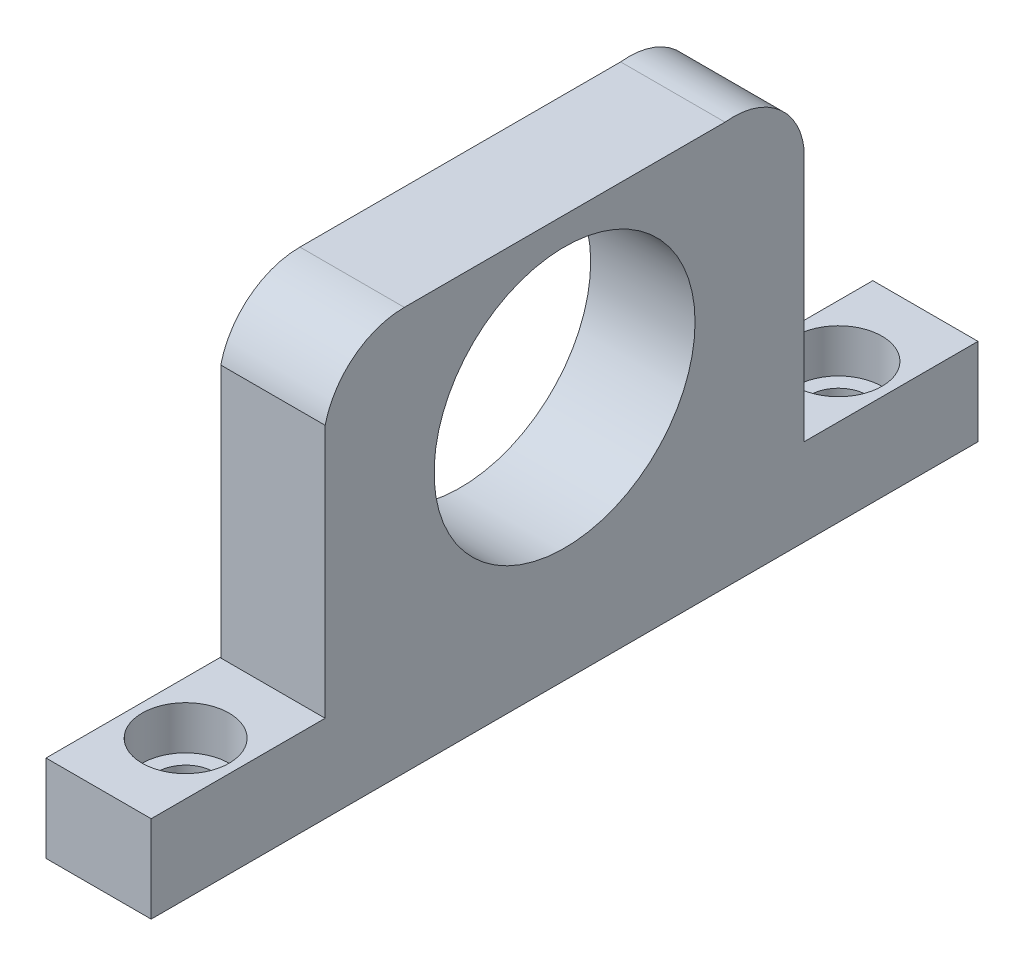
from build123d import *

# Parameters (mm, degrees)
SKETCH1_W           = 2.417978287
SKETCH1_H           = 19.01
SKETCH1_R           = 0.655
BOSS_EXTRUDE1_DEPTH = 2
SKETCH2_R           = 1
CUT_EXTRUDE1_DEPTH  = 1
SKETCH4_R           = 3
BOSS_EXTRUDE3_DEPTH = 2.4


with BuildPart() as part:
    # Sketch1 → Boss-Extrude1 (new body)
    with BuildSketch(Plane(origin=(0, 0, 0), x_dir=(1, 0, 0), z_dir=(0, 1, 0))):
        with Locations((-1.208989143, 14.330251099)):
            Rectangle(SKETCH1_W, SKETCH1_H)
        with Locations(Location((-1.207978287, 6.825251099, 0), (0, 0, 270))):
            Circle(SKETCH1_R, mode=Mode.SUBTRACT)
        with Locations(Location((-1.207978287, 21.835251099, 0), (0, 0, 270))):
            Circle(SKETCH1_R, mode=Mode.SUBTRACT)
    extrude(amount=BOSS_EXTRUDE1_DEPTH)

    # Sketch2 → Cut-Extrude1 (cut)
    with BuildSketch(Plane(origin=(0, 2, 0), x_dir=(1, 0, 0), z_dir=(0, 1, 0))):
        with Locations(Location((-1.207978287, 21.835251099, 0), (0, 0, 270))):
            Circle(SKETCH2_R)
        with Locations(Location((-1.207978287, 6.825251099, 0), (0, 0, 270))):
            Circle(SKETCH2_R)
    extrude(amount=-CUT_EXTRUDE1_DEPTH, mode=Mode.SUBTRACT)

    # Sketch4 → Boss-Extrude3 (add)
    with BuildSketch(Plane(origin=(0, 0, 0), x_dir=(0, 0, -1), z_dir=(1, 0, 0))):
        with BuildLine():
            Line((19.835251099, 2), (8.825251099, 2))
            Line((8.825251099, 2), (8.825251099, 7.833489784))
            ThreePointArc((8.825251099, 7.833489784), (9.485303513, 8.868997702), (10.645251099, 9.272070197))
            Line((10.645251099, 9.272070197), (18.019492282, 9.272070197))
            ThreePointArc((18.019492282, 9.272070197), (19.22631207, 8.930098925), (19.835251099, 7.833489784))
            Line((19.835251099, 7.833489784), (19.835251099, 2))
        make_face()
        with Locations((14.330251099, 5.636035099)):
            Circle(SKETCH4_R, mode=Mode.SUBTRACT)
    extrude(amount=-BOSS_EXTRUDE3_DEPTH)


solid = part.part
